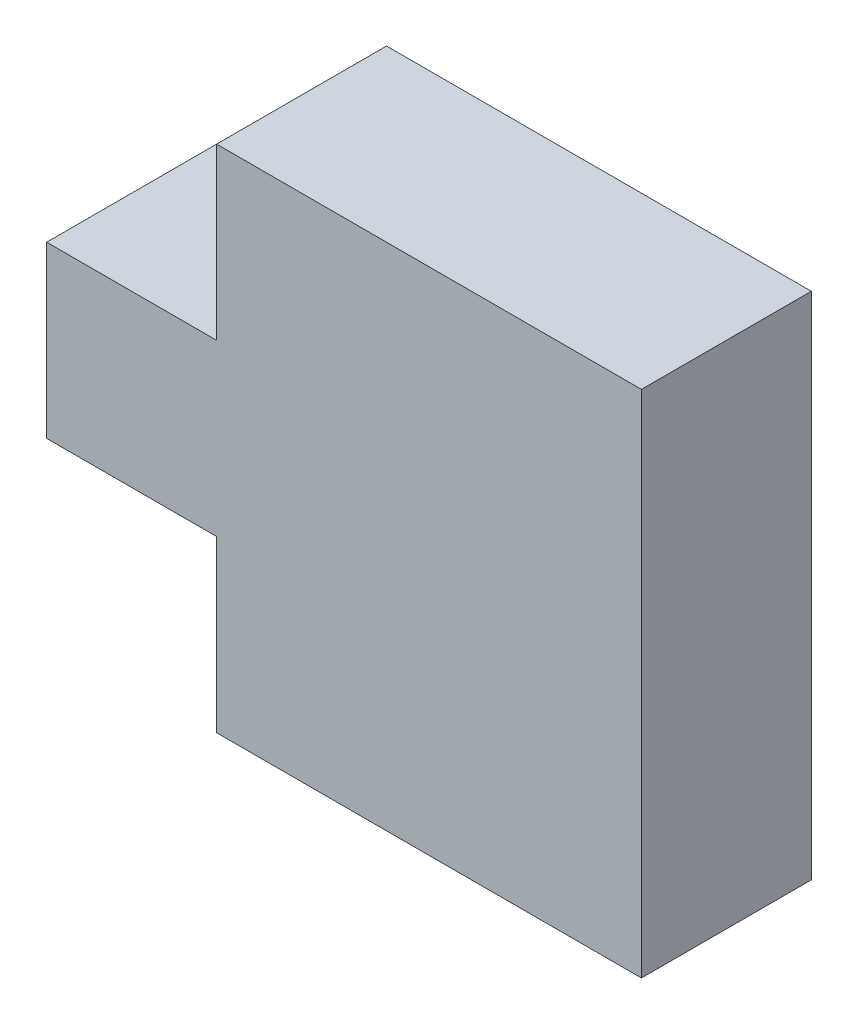
from build123d import *

# Parameters (mm, degrees)
BOSS_EXTRUDE1_DEPTH = 20


with BuildPart() as part:
    # Sketch1 → Boss-Extrude1 (new body)
    with BuildSketch(Plane.XY):
        Polygon((0, 40), (-20, 40), (-20, 20), (0, 20), (0, 0), (50, 0), (50, 60), (0, 60), align=None)
    extrude(amount=BOSS_EXTRUDE1_DEPTH)


solid = part.part
